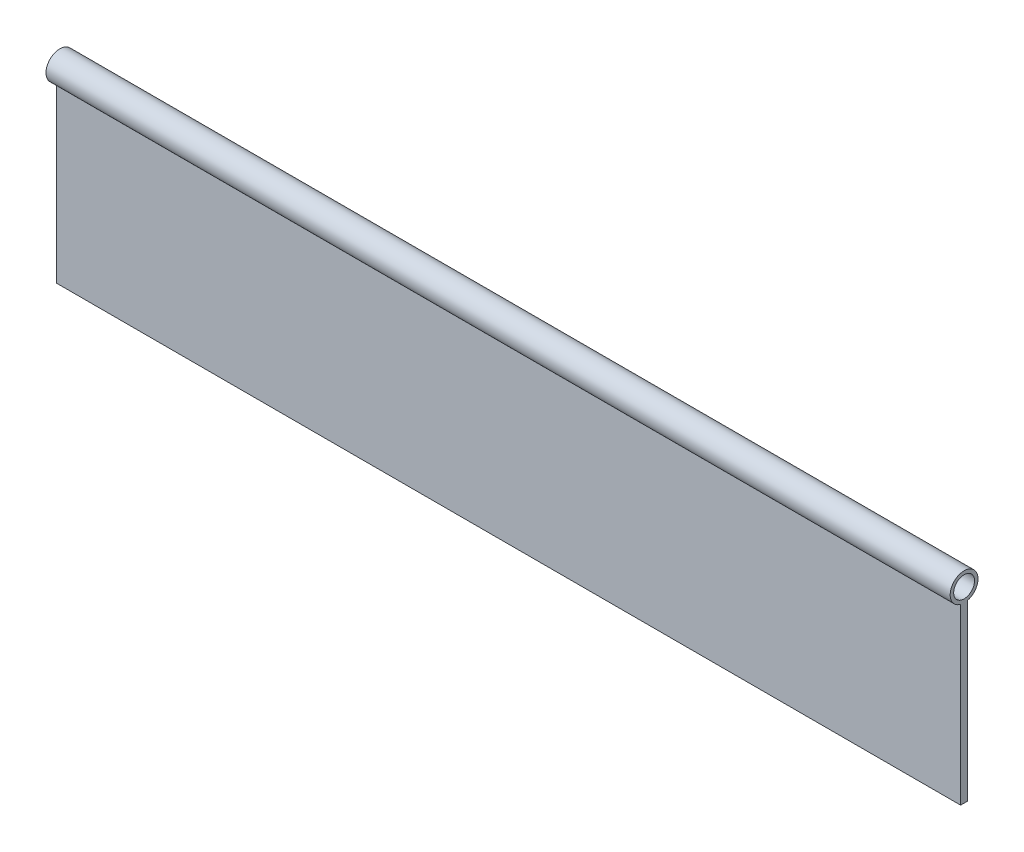
from build123d import *

# Parameters (mm, degrees)
SKETCH1_R           = 3
BOSS_EXTRUDE1_DEPTH = 260


with BuildPart() as part:
    # Sketch1 → Boss-Extrude1 (new body)
    with BuildSketch(Plane(origin=(0, 0, 0), x_dir=(0, 0, -1), z_dir=(1, 0, 0))):
        with BuildLine():
            Line((-1, -3.872983346), (-1, -53.872983346))
            Line((-1, -53.872983346), (1, -53.872983346))
            Line((1, -53.872983346), (1, -3.872983346))
            ThreePointArc((1, -3.872983346), (0, 4), (-1, -3.872983346))
        make_face()
        Circle(SKETCH1_R, mode=Mode.SUBTRACT)
    extrude(amount=BOSS_EXTRUDE1_DEPTH)


solid = part.part
